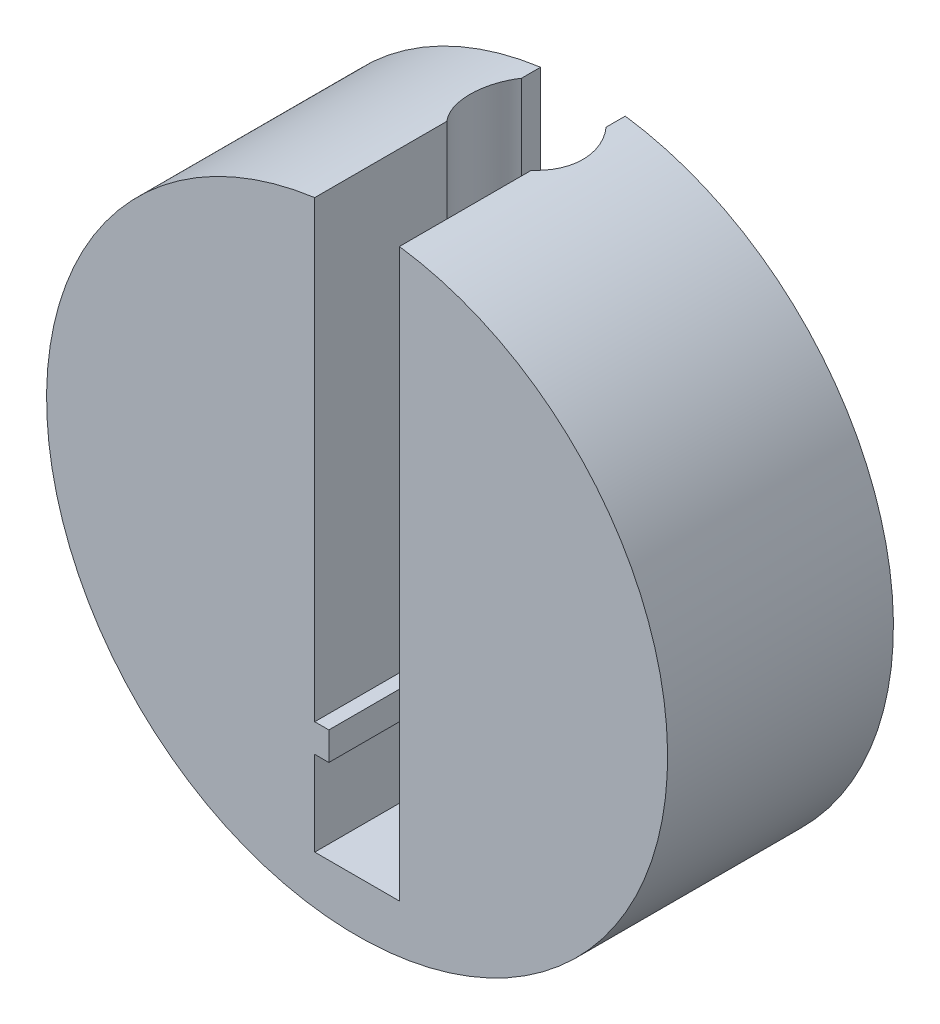
from build123d import *

# Parameters (mm, degrees)
BOSS_EXTRUDE1_DEPTH             = 8
SKETCH8_R                       = 2
PIN_HOLE_DEPTH                  = 5.183346
PIN_HOLE_DIRECTION_2_REACH      = 19.493
PIN_HOLE_DIRECTION_2_END_RADIUS = 11
SKETCH6_W                       = 2
SKETCH6_H                       = 3
CUT_EXTRUDE2_DEPTH              = 2


with BuildPart() as part:
    # Sketch1 → Boss-Extrude1 (new body)
    with BuildSketch(Plane.XY):
        with BuildLine():
            ThreePointArc((-1.5, 10.897247359), (0, -11), (1.5, 10.897247359))
            Line((1.5, 10.897247359), (1.5, -9.183346174))
            Line((1.5, -9.183346174), (-1.5, -9.183346174))
            Line((-1.5, -9.183346174), (-1.5, -6.183346174))
            Line((-1.5, -6.183346174), (-1, -6.183346174))
            Line((-1, -6.183346174), (-1, -5.183346174))
            Line((-1, -5.183346174), (-1.5, -5.183346174))
            Line((-1.5, -5.183346174), (-1.5, 10.897247359))
        make_face()
    extrude(amount=BOSS_EXTRUDE1_DEPTH)

    # Sketch8 → pin hole (cut)
    with BuildSketch(Plane(origin=(0, 0, 0), x_dir=(1, 0, 0), z_dir=(0, 1, 0))):
        with Locations((0, -2)):
            Circle(SKETCH8_R)
    extrude(amount=-PIN_HOLE_DEPTH, mode=Mode.SUBTRACT)

    # pin hole direction 2: up to this cylinder (the profile starts inside it)
    pin_hole_direction_2_end = Plane(origin=(0, 0, 2), z_dir=(0, 0, -1)) * Cylinder(PIN_HOLE_DIRECTION_2_END_RADIUS, 61.986, mode=Mode.PRIVATE)
    # Sketch8 → pin hole direction 2 (cut, up to the surface)
    with BuildSketch(Plane(origin=(0, 0, 0), x_dir=(1, 0, 0), z_dir=(0, 1, 0)), mode=Mode.PRIVATE) as pin_hole_direction_2_sk1:
        with Locations((0, -2)):
            Circle(SKETCH8_R)
    pin_hole_direction_2_tool1 = extrude(pin_hole_direction_2_sk1.sketch, amount=PIN_HOLE_DIRECTION_2_REACH, mode=Mode.PRIVATE) & pin_hole_direction_2_end
    add(pin_hole_direction_2_tool1.solids().sort_by_distance((0, 0, 2))[0], mode=Mode.SUBTRACT)

    # Sketch6 → Cut-Extrude2 (cut)
    with BuildSketch(Plane(origin=(0, 0, 0), x_dir=(-1, 0, 0), z_dir=(0, 0, -1))):
        with Locations((-5, 0)):
            Rectangle(SKETCH6_W, SKETCH6_H)
        with Locations((5, 0)):
            Rectangle(SKETCH6_W, SKETCH6_H)
    extrude(amount=-CUT_EXTRUDE2_DEPTH, mode=Mode.SUBTRACT)


solid = part.part
